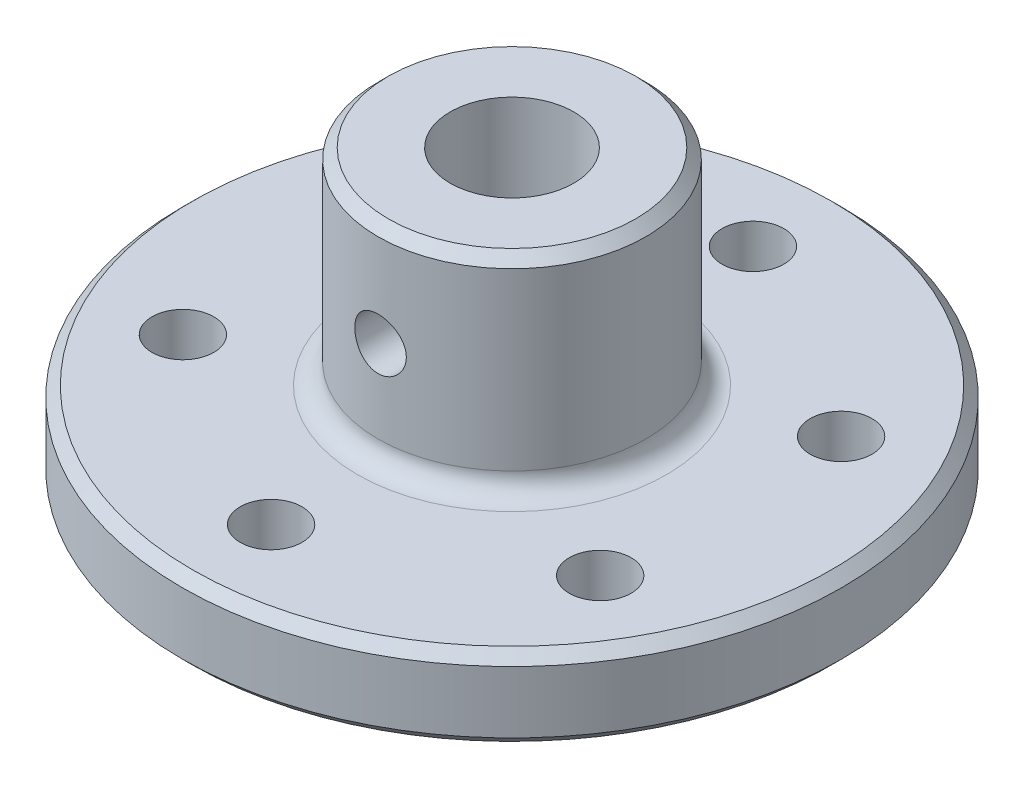
from build123d import *

# Parameters (mm, degrees)
SKETCH1_R               = 16
SKETCH1_R_2             = 1.5
SKETCH1_R_3             = 3
BOSS_EXTRUDE1_DEPTH     = 4
SKETCH2_R               = 6.5
SKETCH2_R_2             = 3
BOSS_EXTRUDE2_DEPTH     = 10
FILLET1_R               = 1
CUT_EXTRUDE1_DEPTH      = 27.608269391
CUT_EXTRUDE1_DEPTH_BACK = 27.608269391
SKETCH3_R               = 1.25
CHAMFER1_SIZE           = 0.5


with BuildPart() as part:
    # Sketch1 → Boss-Extrude1 (new body)
    with BuildSketch(Plane(origin=(0, 0, 0), x_dir=(1, 0, 0), z_dir=(0, 1, 0))):
        with Locations(Location((0, 0, 0), (0, 0, 270))):
            Circle(SKETCH1_R)
        with Locations(Location((0, 11.691342951, 0), (0, 0, 270))):
            Circle(SKETCH1_R_2, mode=Mode.SUBTRACT)
        with Locations(Location((10.125, 5.845671476, 0), (0, 0, 270))):
            Circle(SKETCH1_R_2, mode=Mode.SUBTRACT)
        with Locations(Location((10.125, -5.845671476, 0), (0, 0, 270))):
            Circle(SKETCH1_R_2, mode=Mode.SUBTRACT)
        with Locations(Location((0, -11.691342951, 0), (0, 0, 270))):
            Circle(SKETCH1_R_2, mode=Mode.SUBTRACT)
        with Locations(Location((-10.125, -5.845671476, 0), (0, 0, 270))):
            Circle(SKETCH1_R_2, mode=Mode.SUBTRACT)
        with Locations(Location((-10.125, 5.845671476, 0), (0, 0, 270))):
            Circle(SKETCH1_R_2, mode=Mode.SUBTRACT)
        with Locations(Location((0, 0, 0), (0, 0, 270))):
            Circle(SKETCH1_R_3, mode=Mode.SUBTRACT)
    extrude(amount=BOSS_EXTRUDE1_DEPTH)

    # Sketch2 → Boss-Extrude2 (add)
    with BuildSketch(Plane(origin=(0, 4, 0), x_dir=(1, 0, 0), z_dir=(0, 1, 0))):
        with Locations(Location((0, 0, 0), (0, 0, 270))):
            Circle(SKETCH2_R)
        with Locations(Location((0, 0, 0), (0, 0, 270))):
            Circle(SKETCH2_R_2, mode=Mode.SUBTRACT)
    extrude(amount=BOSS_EXTRUDE2_DEPTH)

    # Fillet1
    fillet1_edges = [part.edges().sort_by_distance(p)[0] for p in [
        (0, 4, -6.5),
    ]]
    fillet(fillet1_edges, radius=FILLET1_R)

    # Sketch3 → Cut-Extrude1 (cut, two sides: drawn at the far end of the back side and taken through both)
    with BuildSketch(Plane.XY.offset(-CUT_EXTRUDE1_DEPTH_BACK)):
        with Locations((0, 9)):
            Circle(SKETCH3_R)
    extrude(amount=CUT_EXTRUDE1_DEPTH + CUT_EXTRUDE1_DEPTH_BACK, mode=Mode.SUBTRACT)

    # Chamfer1
    chamfer1_edges = [part.edges().sort_by_distance(p)[0] for p in [
        (0, 0, -16),
        (0, 14, -6.5),
        (0, 4, -16),
    ]]
    chamfer(chamfer1_edges, length=CHAMFER1_SIZE)


solid = part.part
